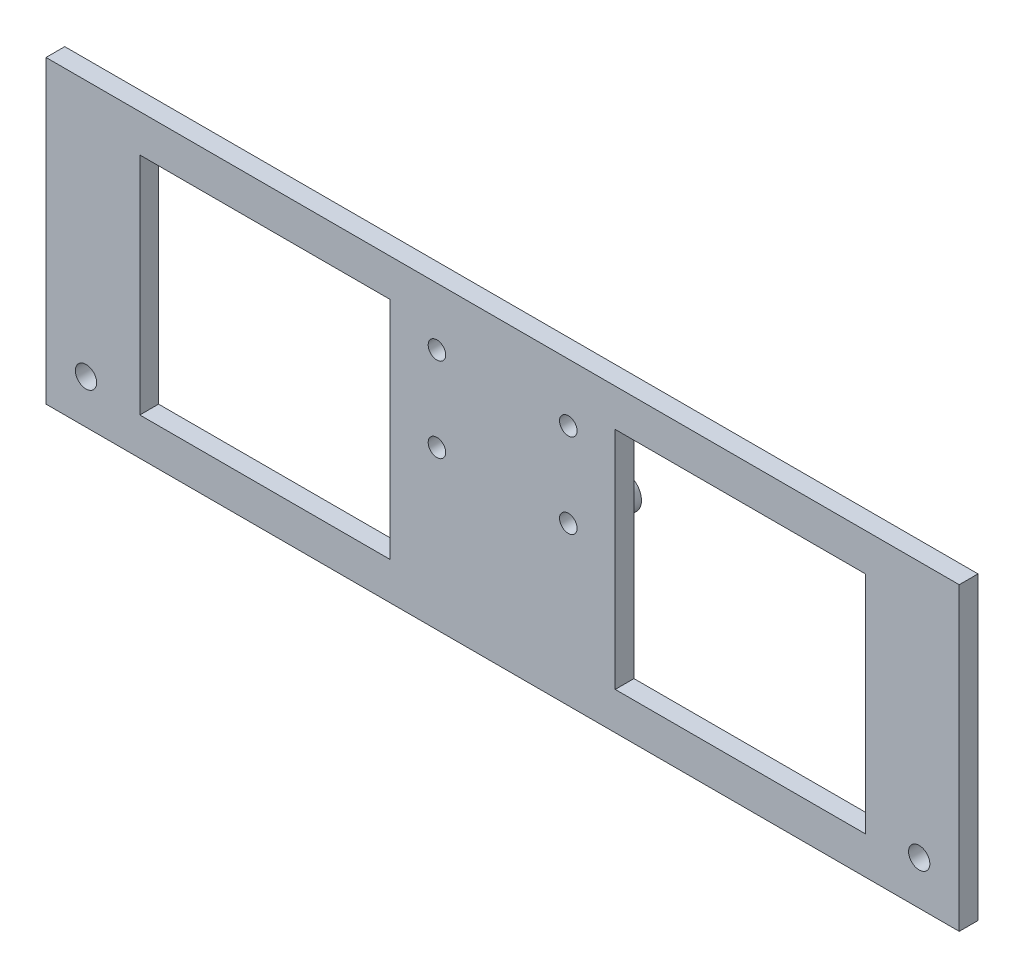
from build123d import *

# Parameters (mm, degrees)
SKETCH_1_W                 = 146
SKETCH_1_H                 = 48
EXTRUDE_146X48_DEPTH       = 3
CUT_EXTRUDE_492_DEPTH      = 80.76214641
CUT_EXTRUDE_492_DEPTH_BACK = 80.76214641
SKETCH_2_W                 = 40
SKETCH_2_H                 = 36
F_6MM_START                = -6
SKETCH_3_R                 = 2.7
F_6MM_DEPTH                = 6
F_2P8_3P4_DEPTH            = 80.931220434
F_2P8_3P4_DEPTH_BACK       = 80.931220434
SKETCH_4_R                 = 1.4
SKETCH_4_R_2               = 1.7


with BuildPart() as part:
    # 草图1 → 相机横梁146x48 (new body)
    with BuildSketch(Plane.XY):
        with Locations((0, -8)):
            Rectangle(SKETCH_1_W, SKETCH_1_H)
    extrude(amount=EXTRUDE_146X48_DEPTH)

    # 草图2 → Cut-Extrude 492 (cut, two sides: drawn at the far end of the back side and taken through both)
    with BuildSketch(Plane.XY.offset(-CUT_EXTRUDE_492_DEPTH_BACK)):
        with Locations((-38, -8)):
            Rectangle(SKETCH_2_W, SKETCH_2_H)
        with Locations((38, -8)):
            Rectangle(SKETCH_2_W, SKETCH_2_H)
    extrude(amount=CUT_EXTRUDE_492_DEPTH + CUT_EXTRUDE_492_DEPTH_BACK, mode=Mode.SUBTRACT)

    # 草图3 → 背面6mm间隔柱 (add)
    with BuildSketch(Plane.XY.offset(F_6MM_START)):
        with Locations((-10.5, -6.75)):
            Circle(SKETCH_3_R)
        with Locations((-10.5, 6.75)):
            Circle(SKETCH_3_R)
        with Locations((10.5, -6.75)):
            Circle(SKETCH_3_R)
        with Locations((10.5, 6.75)):
            Circle(SKETCH_3_R)
    extrude(amount=F_6MM_DEPTH)

    # 草图4 → 相机2p8孔与梁端3p4孔 (cut, two sides: drawn at the far end of the back side and taken through both)
    with BuildSketch(Plane.XY.offset(-F_2P8_3P4_DEPTH_BACK)):
        with Locations((-10.5, -6.75)):
            Circle(SKETCH_4_R)
        with Locations((-10.5, 6.75)):
            Circle(SKETCH_4_R)
        with Locations((10.5, -6.75)):
            Circle(SKETCH_4_R)
        with Locations((10.5, 6.75)):
            Circle(SKETCH_4_R)
        with Locations((-66.6, -25)):
            Circle(SKETCH_4_R_2)
        with Locations((66.6, -25)):
            Circle(SKETCH_4_R_2)
    extrude(amount=F_2P8_3P4_DEPTH + F_2P8_3P4_DEPTH_BACK, mode=Mode.SUBTRACT)


solid = part.part
